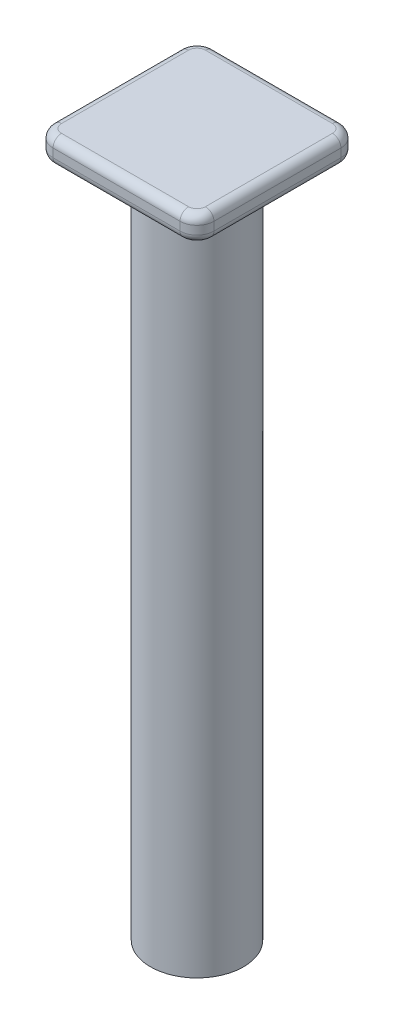
from build123d import *

# Parameters (mm, degrees)
BOSS_EXTRUDE1_DEPTH = 1.905
SKETCH2_R           = 3.4925
SKETCH2_R_2         = 2.54
BOSS_EXTRUDE2_DEPTH = 50.8
FILLET2_R           = 0.635
SCALE1_SCALE        = 1.5


with BuildPart() as part:
    # Sketch1 → Boss-Extrude1 (new body)
    with BuildSketch(Plane(origin=(0, 0, 0), x_dir=(1, 0, 0), z_dir=(0, 1, 0))):
        with BuildLine():
            Line((-6.0325, -4.7625), (-6.0325, 4.7625))
            ThreePointArc((-6.0325, 4.7625), (-5.660525612, 5.660525612), (-4.7625, 6.0325))
            Line((-4.7625, 6.0325), (4.7625, 6.0325))
            ThreePointArc((4.7625, 6.0325), (5.660525612, 5.660525612), (6.0325, 4.7625))
            Line((6.0325, 4.7625), (6.0325, -4.7625))
            ThreePointArc((6.0325, -4.7625), (5.660525612, -5.660525612), (4.7625, -6.0325))
            Line((4.7625, -6.0325), (-4.7625, -6.0325))
            ThreePointArc((-4.7625, -6.0325), (-5.660525612, -5.660525612), (-6.0325, -4.7625))
        make_face()
    extrude(amount=BOSS_EXTRUDE1_DEPTH)

    # Sketch2 → Boss-Extrude2 (add)
    with BuildSketch(Plane.XZ):
        with Locations(Location((0, 0, 0), (0, 0, 270))):
            Circle(SKETCH2_R)
        with Locations(Location((0, 0, 0), (0, 0, 270))):
            Circle(SKETCH2_R_2, mode=Mode.SUBTRACT)
    extrude(amount=BOSS_EXTRUDE2_DEPTH)

    # Fillet2
    fillet2_edges = [part.edges().sort_by_distance(p)[0] for p in [
        (-5.660525612, 1.905, -5.660525612),
        (0, 0, -6.0325),
        (5.660525612, 0, -5.660525612),
        (-6.0325, 1.905, 0),
        (-5.660525612, 1.905, 5.660525612),
        (0, 1.905, 6.0325),
        (5.660525612, 1.905, 5.660525612),
        (6.0325, 1.905, 0),
        (5.660525612, 1.905, -5.660525612),
        (0, 1.905, -6.0325),
        (6.0325, 0, 0),
        (5.660525612, 0, 5.660525612),
        (0, 0, 6.0325),
        (-5.660525612, 0, 5.660525612),
        (-6.0325, 0, 0),
        (-5.660525612, 0, -5.660525612),
    ]]
    fillet(fillet2_edges, radius=FILLET2_R)


with BuildPart() as part_1:
    # Scale1: scaled about (0, -19.460130845, 0)
    add(part.part.scale(SCALE1_SCALE).moved(Location((0, 9.730065422, 0))))


solid = part_1.part
